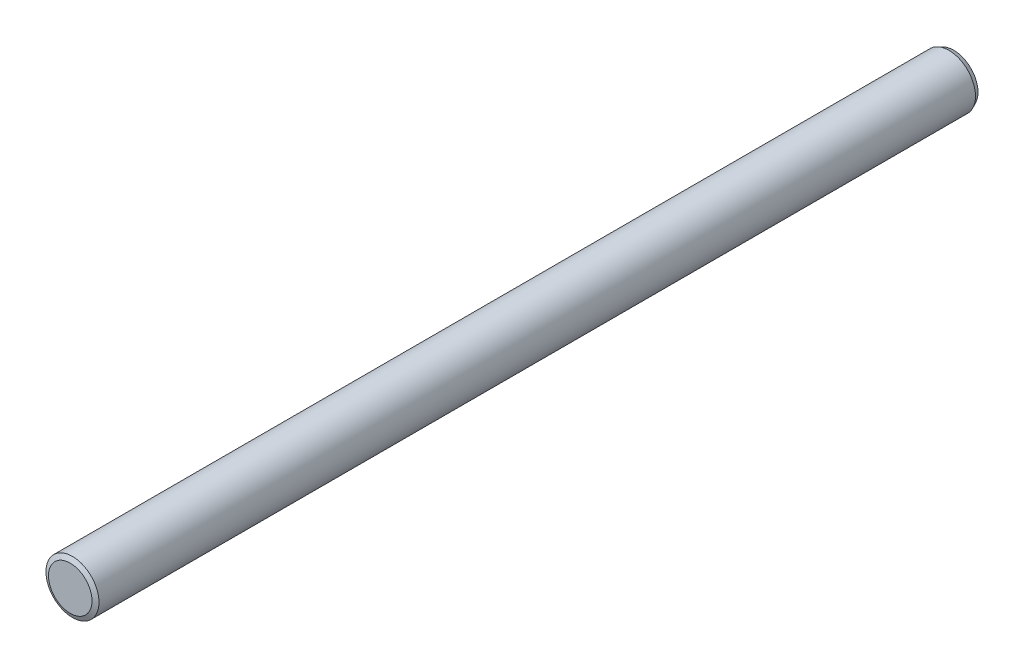
from build123d import *
from OCP.BRepFilletAPI import BRepFilletAPI_MakeChamfer

# Parameters (mm, degrees)
SKETCH1_R           = 3
BOSS_EXTRUDE1_DEPTH = 50
CHAMFER1_SIZE       = 0.25
CHAMFER1_SIZE2      = 0.53612673


with BuildPart() as part:
    # Sketch1 → Boss-Extrude1 (new, symmetric)
    with BuildSketch(Plane.XY):
        Circle(SKETCH1_R)
    extrude(amount=BOSS_EXTRUDE1_DEPTH, both=True)

    # Chamfer1: one chamfer whose edges measure the first distance from different faces: ONE call of the kernel's chamfer builder (chamfer() names one face for all edges)
    chamfer1_edges_1 = [part.edges().sort_by_distance(p)[0] for p in [
        (-3, 0, -50),
    ]]
    chamfer1_side_1 = [part.faces().sort_by_distance(p)[0] for p in [
        (0, 0, -50),
    ]]
    chamfer1_edges_2 = [part.edges().sort_by_distance(p)[0] for p in [
        (-3, 0, 50),
    ]]
    chamfer1_side_2 = [part.faces().sort_by_distance(p)[0] for p in [
        (-3, 0, 0),
    ]]
    chamfer1 = BRepFilletAPI_MakeChamfer(part.part.solid().wrapped)
    for e in chamfer1_edges_1:
        chamfer1.Add(CHAMFER1_SIZE, CHAMFER1_SIZE2, e.wrapped, chamfer1_side_1[0].wrapped)  # the first distance lies on this face
    for e in chamfer1_edges_2:
        chamfer1.Add(CHAMFER1_SIZE, CHAMFER1_SIZE2, e.wrapped, chamfer1_side_2[0].wrapped)  # the first distance lies on this face
    add(Compound.cast(chamfer1.Shape()), mode=Mode.REPLACE)


solid = part.part
